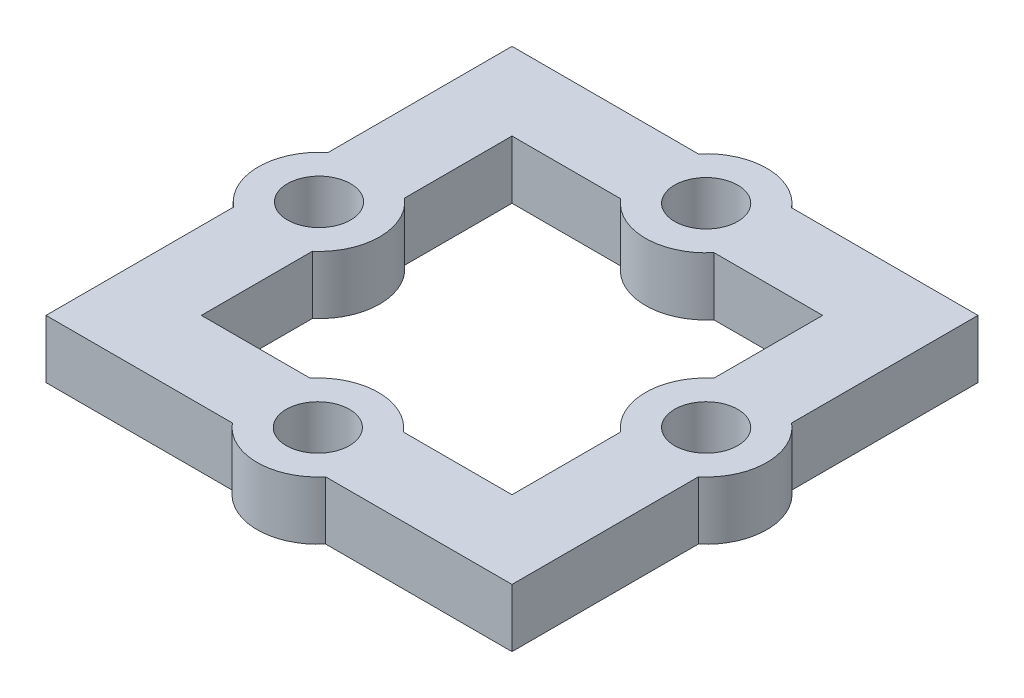
from build123d import *

# Parameters (mm, degrees)
SKETCH1_R           = 3.25
BOSS_EXTRUDE1_DEPTH = 6


with BuildPart() as part:
    # Sketch1 → Boss-Extrude1 (new body)
    with BuildSketch(Plane(origin=(0, 0, 0), x_dir=(1, 0, 0), z_dir=(0, 1, 0))):
        with BuildLine():
            Line((-24, -4.668943148), (-24, -24))
            Line((-24, -24), (-4.802343178, -24))
            ThreePointArc((-4.802343178, -24), (0, -26.25), (4.802343178, -24))
            Line((4.802343178, -24), (24, -24))
            Line((24, -24), (24, -4.802343178))
            ThreePointArc((24, -4.802343178), (26.25, 0), (24, 4.802343178))
            Line((24, 4.802343178), (24, 24))
            Line((24, 24), (4.802343178, 24))
            ThreePointArc((4.802343178, 24), (0, 26.25), (-4.802343178, 24))
            Line((-4.802343178, 24), (-24, 24))
            Line((-24, 24), (-24, 5.04363247))
            ThreePointArc((-24, 5.04363247), (-26.315667945, 0.187344661), (-24, -4.668943148))
        make_face()
        with Locations(Location((-20.065667945, 0.187344661, 0), (0, 0, 270))):
            Circle(SKETCH1_R, mode=Mode.SUBTRACT)
        with Locations(Location((0, 20, 0), (0, 0, 270))):
            Circle(SKETCH1_R, mode=Mode.SUBTRACT)
        with Locations(Location((20, 0, 0), (0, 0, 270))):
            Circle(SKETCH1_R, mode=Mode.SUBTRACT)
        with Locations(Location((0, -20, 0), (0, 0, 270))):
            Circle(SKETCH1_R, mode=Mode.SUBTRACT)
        with BuildLine():
            Line((-16, 16), (-4.802343178, 16))
            ThreePointArc((-4.802343178, 16), (0, 13.75), (4.802343178, 16))
            Line((4.802343178, 16), (16, 16))
            Line((16, 16), (16, 4.802343178))
            ThreePointArc((16, 4.802343178), (13.75, 0), (16, -4.802343178))
            Line((16, -4.802343178), (16, -16))
            Line((16, -16), (4.802343178, -16))
            ThreePointArc((4.802343178, -16), (0, -13.75), (-4.802343178, -16))
            Line((-4.802343178, -16), (-16, -16))
            Line((-16, -16), (-16, -4.559532645))
            ThreePointArc((-16, -4.559532645), (-13.815667945, 0.187344661), (-16, 4.934221967))
            Line((-16, 4.934221967), (-16, 16))
        make_face(mode=Mode.SUBTRACT)
    extrude(amount=BOSS_EXTRUDE1_DEPTH)


solid = part.part
